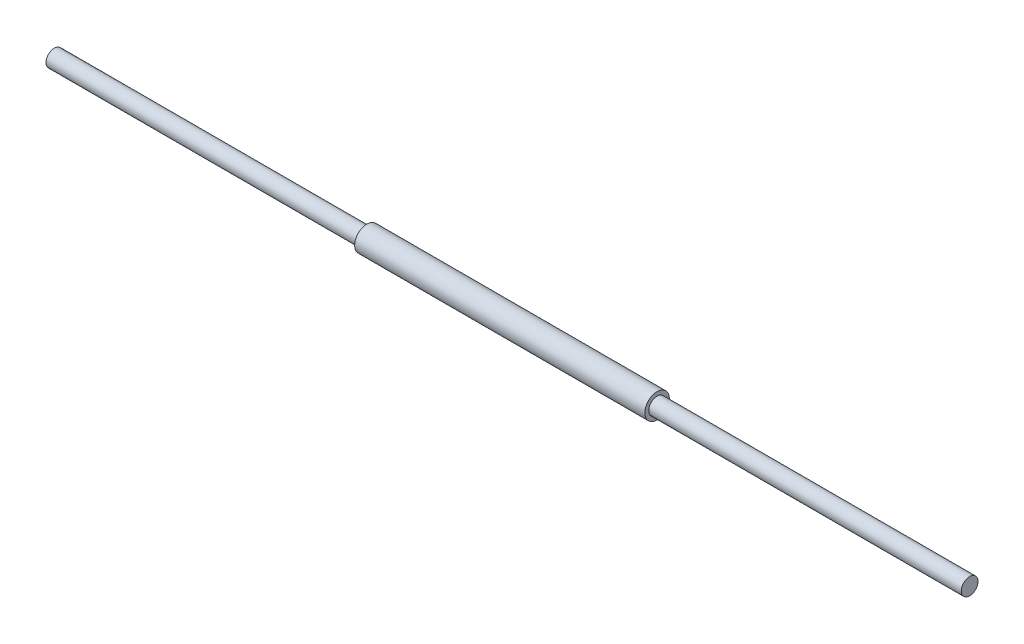
from build123d import *

# Parameters (mm, degrees)
SKETCH3_W = 177.8
SKETCH3_H = 4.7625


with BuildPart() as part:
    # Sketch3 → Revolve2 (revolve)
    with BuildSketch(Plane.XY, mode=Mode.PRIVATE) as revolve2_sk:
        Polygon((260.35, 0), (260.35, 6.985), (177.8, 6.985), (177.8, 4.7625), (177.8, 0), align=None)
        with Locations((88.9, 2.38125)):
            Rectangle(SKETCH3_W, SKETCH3_H)
        Polygon((342.9, 6.985), (260.35, 6.985), (260.35, 0), (342.9, 0), (342.9, 4.7625), align=None)
        with Locations((431.8, 2.38125)):
            Rectangle(SKETCH3_W, SKETCH3_H)
    revolve(revolve2_sk.sketch.rotate(Axis((342.9, 0, 0), (1, 0, 0)), 90), axis=Axis((342.9, 0, 0), (1, 0, 0)))


solid = part.part
